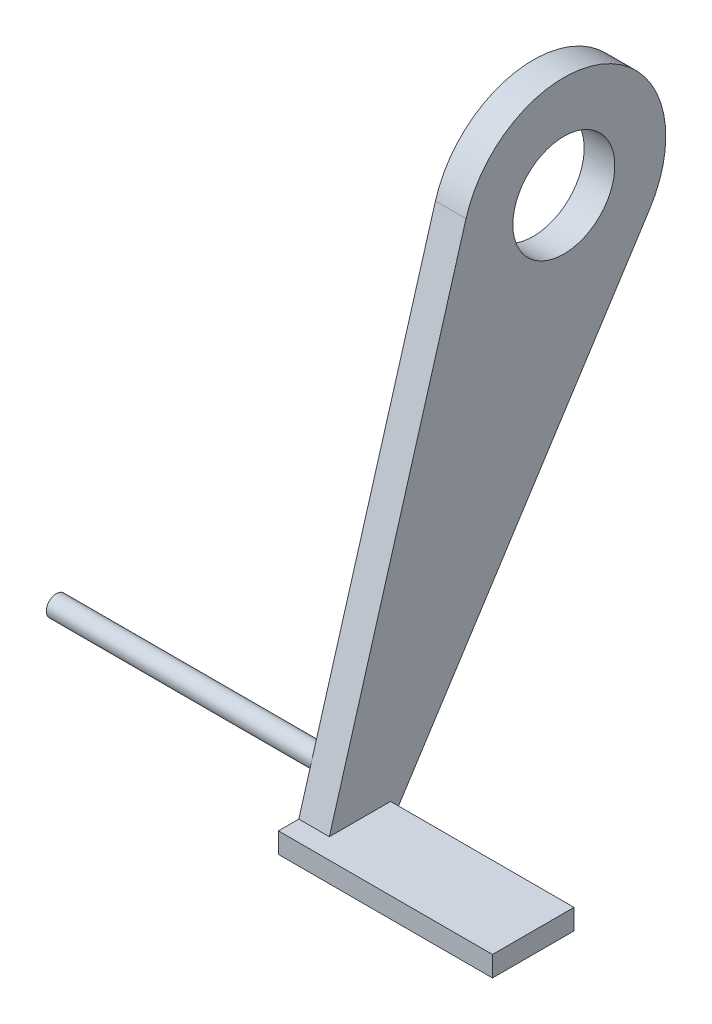
from build123d import *

# Parameters (mm, degrees)
BOSS_EXTRUDE1_DEPTH = 5.334
SKETCH1_3_R         = 1.27
BOSS_EXTRUDE2_DEPTH = 0.762
SKETCH2_R           = 0.254
BOSS_EXTRUDE3_DEPTH = 6.604


with BuildPart() as part:
    # Sketch1 → Boss-Extrude1 (new body)
    with BuildSketch(Plane(origin=(0, 0, 0), x_dir=(0, 0, -1), z_dir=(1, 0, 0))):
        Polygon((-6.35, -11.43), (-4.318, -11.43), (-4.318, -10.922), (-5.842, -10.922), (-6.35, -10.922), align=None)
    extrude(amount=BOSS_EXTRUDE1_DEPTH)

    # Sketch1<3> → Boss-Extrude2 (add)
    with BuildSketch(Plane(origin=(0, 0, 0), x_dir=(0, 0, -1), z_dir=(1, 0, 0))):
        with BuildLine():
            Line((-4.318, -11.43), (2.137587014, -1.371977316))
            ThreePointArc((2.137587014, -1.371977316), (1.053360752, 2.311283437), (-2.437803052, 0.713243493))
            Line((-2.437803052, 0.713243493), (-5.842, -10.922))
            Line((-5.842, -10.922), (-4.318, -10.922))
            Line((-4.318, -10.922), (-4.318, -11.43))
        make_face()
        Circle(SKETCH1_3_R, mode=Mode.SUBTRACT)
    extrude(amount=BOSS_EXTRUDE2_DEPTH)

    # Sketch2 → Boss-Extrude3 (add)
    with BuildSketch(Plane.ZY):
        with Locations((5.27681031, -9.894775555)):
            Circle(SKETCH2_R)
    extrude(amount=BOSS_EXTRUDE3_DEPTH)


solid = part.part
